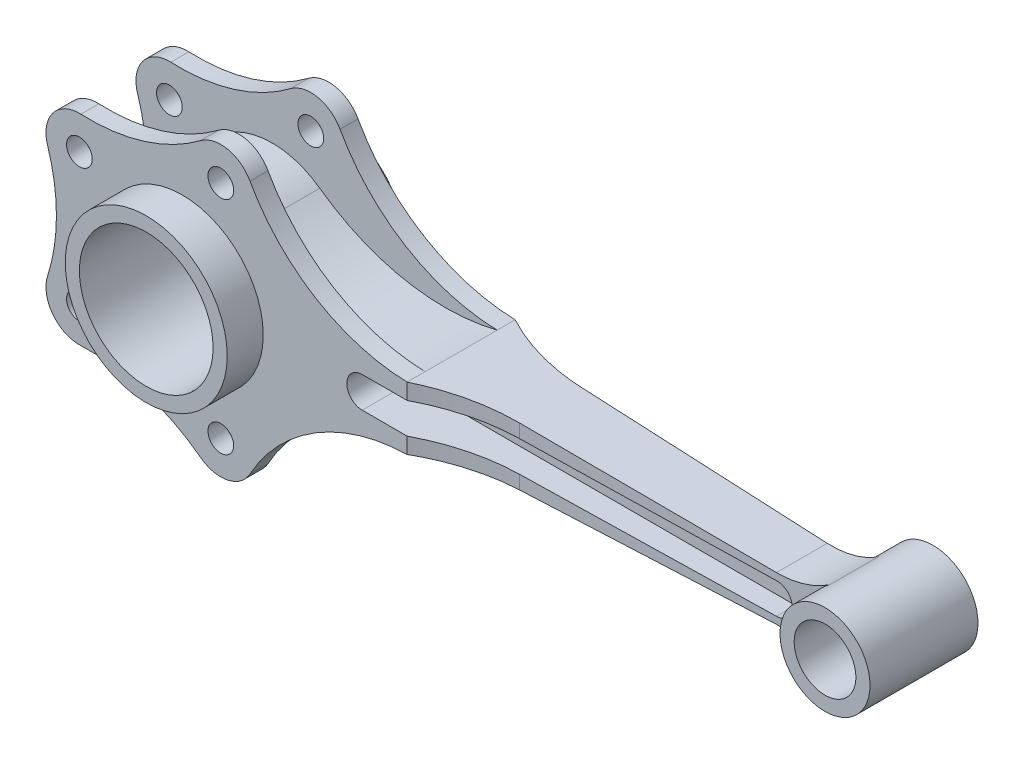
from build123d import *

# Parameters (mm, degrees)
SKETCH1_R               = 31.5
SKETCH1_R_2             = 26
BOSS_EXTRUDE1_DEPTH     = 35
SKETCH1_3_R             = 5
SKETCH1_3_R_2           = 31.5
BOSS_EXTRUDE2_DEPTH     = 21
BOSS_EXTRUDE3_DEPTH     = 2.5
CUT_EXTRUDE1_DEPTH      = 250.214133183
CUT_EXTRUDE1_DEPTH_BACK = 250.214133183
SKETCH1_5_R             = 12
BOSS_EXTRUDE4_DEPTH     = 21
CUT_EXTRUDE2_DEPTH      = 14


with BuildPart() as part:
    # Sketch1 → Boss-Extrude1 (new, symmetric)
    with BuildSketch(Plane.XY):
        Circle(SKETCH1_R)
        Circle(SKETCH1_R_2, mode=Mode.SUBTRACT)
    extrude(amount=BOSS_EXTRUDE1_DEPTH, both=True)

    # Sketch1<3> → Boss-Extrude2 (add, symmetric)
    with BuildSketch(Plane.XY):
        with BuildLine():
            Line((220, 8.719912605), (87.482015231, 12.190018161))
            ThreePointArc((87.482015231, 12.190018161), (51.997088566, 22.622612499), (26.373739078, 49.29587638))
            ThreePointArc((26.373739078, 49.29587638), (17.709961948, 55.714405462), (7.181946677, 53.386435492))
            ThreePointArc((7.181946677, 53.386435492), (-14.855989459, 42.122318837), (-39.406288617, 38.986435492))
            ThreePointArc((-39.406288617, 38.986435492), (-50.326951915, 33.896458963), (-52.376901133, 22.023529412))
            ThreePointArc((-52.376901133, 22.023529412), (-48.925892025, 0), (-52.376901133, -22.023529412))
            ThreePointArc((-52.376901133, -22.023529412), (-50.326951915, -33.896458963), (-39.406288617, -38.986435492))
            ThreePointArc((-39.406288617, -38.986435492), (-14.855989459, -42.122318837), (7.181946677, -53.386435492))
            ThreePointArc((7.181946677, -53.386435492), (17.709961948, -55.714405462), (26.373739078, -49.29587638))
            ThreePointArc((26.373739078, -49.29587638), (51.997088566, -22.622612499), (87.482015231, -12.190018161))
            Line((87.482015231, -12.190018161), (220, -8.719912605))
            ThreePointArc((220, -8.719912605), (230.604685788, -10.075596562), (240.30539773, -14.569306326))
            ThreePointArc((240.30539773, -14.569306326), (232.5, 0), (240.30539773, 14.569306326))
            ThreePointArc((240.30539773, 14.569306326), (230.604685788, 10.075596562), (220, 8.719912605))
        make_face()
        with Locations((15, -43)):
            Circle(SKETCH1_3_R, mode=Mode.SUBTRACT)
        with Locations((-40, -26)):
            Circle(SKETCH1_3_R, mode=Mode.SUBTRACT)
        Circle(SKETCH1_3_R_2, mode=Mode.SUBTRACT)
        with Locations((-40, 26)):
            Circle(SKETCH1_3_R, mode=Mode.SUBTRACT)
        with Locations((15, 43)):
            Circle(SKETCH1_3_R, mode=Mode.SUBTRACT)
        with BuildLine():
            ThreePointArc((70, -6), (64, 0), (70, 6))
            Line((70, 6), (220, 6))
            ThreePointArc((220, 6), (226, 0), (220, -6))
            Line((220, -6), (70, -6))
        make_face(mode=Mode.SUBTRACT)
    extrude(amount=BOSS_EXTRUDE2_DEPTH, both=True)

    # Sketch1<4> → Boss-Extrude3 (add, symmetric)
    with BuildSketch(Plane.XY):
        with BuildLine():
            Line((220, 6), (70, 6))
            ThreePointArc((70, 6), (64, 0), (70, -6))
            Line((70, -6), (220, -6))
            ThreePointArc((220, -6), (226, 0), (220, 6))
        make_face()
    extrude(amount=BOSS_EXTRUDE3_DEPTH, both=True)

    # Sketch2 → Cut-Extrude1 (cut, two sides: drawn at the far end of the back side and taken through both)
    with BuildSketch(Plane(origin=(0, 0, 0), x_dir=(1, 0, 0), z_dir=(0, 1, 0)).offset(-CUT_EXTRUDE1_DEPTH_BACK)):
        with BuildLine():
            Line((240.30539773, -9.422684737), (122.188711449, -12))
            ThreePointArc((122.188711449, -12), (104.311213199, -14.478720031), (87.482015231, -21))
            Line((87.482015231, -21), (240.30539773, -21))
            Line((240.30539773, -21), (240.30539773, -9.422684737))
        make_face()
        with BuildLine():
            Line((240.30539773, 9.422684737), (122.188711449, 12))
            ThreePointArc((122.188711449, 12), (104.311213199, 14.478720031), (87.482015231, 21))
            Line((87.482015231, 21), (240.30539773, 21))
            Line((240.30539773, 21), (240.30539773, 9.422684737))
        make_face()
    extrude(amount=CUT_EXTRUDE1_DEPTH + CUT_EXTRUDE1_DEPTH_BACK, mode=Mode.SUBTRACT)

    # Sketch1<5> → Boss-Extrude4 (add, symmetric)
    with BuildSketch(Plane.XY):
        with BuildLine():
            ThreePointArc((267.5, 0), (258.264213825, 15.425717807), (240.30539773, 14.569306326))
            ThreePointArc((240.30539773, 14.569306326), (232.5, 0), (240.30539773, -14.569306326))
            ThreePointArc((240.30539773, -14.569306326), (258.264213825, -15.425717807), (267.5, 0))
        make_face()
        with Locations((250, 0)):
            Circle(SKETCH1_5_R, mode=Mode.SUBTRACT)
    extrude(amount=BOSS_EXTRUDE4_DEPTH, both=True)

    # Sketch3 → Cut-Extrude2 (cut, symmetric)
    with BuildSketch(Plane.XY):
        with BuildLine():
            ThreePointArc((18.496414213, 25.497699136), (51.511708097, 11.184621648), (87.482015231, 12.190018161))
            ThreePointArc((87.482015231, 12.190018161), (51.997088566, 22.622612499), (26.373739078, 49.29587638))
            ThreePointArc((26.373739078, 49.29587638), (17.709961948, 55.714405462), (7.181946677, 53.386435492))
            ThreePointArc((7.181946677, 53.386435492), (-14.855989459, 42.122318837), (-39.406288617, 38.986435492))
            ThreePointArc((-39.406288617, 38.986435492), (-50.326951915, 33.896458963), (-52.376901133, 22.023529412))
            ThreePointArc((-52.376901133, 22.023529412), (-48.925892025, 0), (-52.376901133, -22.023529412))
            ThreePointArc((-52.376901133, -22.023529412), (-50.326951915, -33.896458963), (-39.406288617, -38.986435492))
            ThreePointArc((-39.406288617, -38.986435492), (-14.855989459, -42.122318837), (7.181946677, -53.386435492))
            ThreePointArc((7.181946677, -53.386435492), (17.709961948, -55.714405462), (26.373739078, -49.29587638))
            ThreePointArc((26.373739078, -49.29587638), (51.997088566, -22.622612499), (87.482015231, -12.190018161))
            ThreePointArc((87.482015231, -12.190018161), (51.511708097, -11.184621648), (18.496414213, -25.497699136))
            ThreePointArc((18.496414213, -25.497699136), (-31.5, 0), (18.496414213, 25.497699136))
        make_face()
    extrude(amount=CUT_EXTRUDE2_DEPTH, both=True, mode=Mode.SUBTRACT)


solid = part.part
